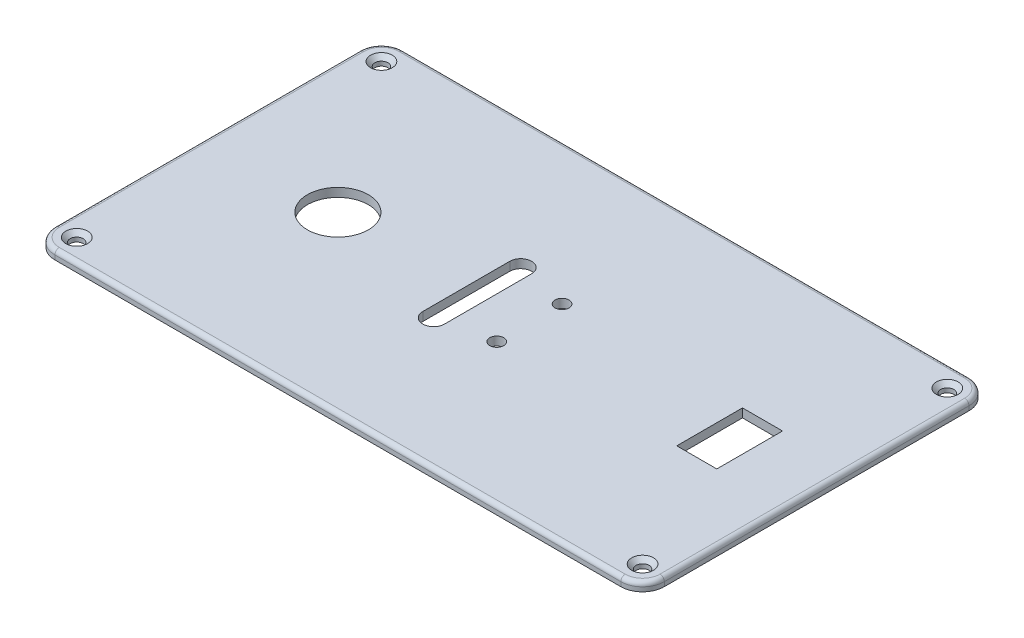
from build123d import *

# Parameters (mm, degrees)
SALIENTE_EXTRUIR1_DEPTH = 2
CROQUIS2_R              = 1.5
CORTAR_EXTRUIR1_DEPTH   = 2
CHAFL_N1_SIZE           = 1
CROQUIS3_R              = 1.6
CORTAR_EXTRUIR2_DEPTH   = 2
CROQUIS4_R              = 7
CROQUIS4_W              = 9.2
CROQUIS4_H              = 15.1
CORTAR_EXTRUIR3_DEPTH   = 2
REDONDEO1_R             = 1


with BuildPart() as part:
    # Croquis1 → Saliente-Extruir1 (new body)
    with BuildSketch(Plane(origin=(0, 0, 0), x_dir=(1, 0, 0), z_dir=(0, 1, 0))):
        with BuildLine():
            Line((-65, -40), (65, -40))
            ThreePointArc((65, -40), (68.535533906, -38.535533906), (70, -35))
            Line((70, -35), (70, 35))
            ThreePointArc((70, 35), (68.535533906, 38.535533906), (65, 40))
            Line((65, 40), (-65, 40))
            ThreePointArc((-65, 40), (-68.535533906, 38.535533906), (-70, 35))
            Line((-70, 35), (-70, -35))
            ThreePointArc((-70, -35), (-68.535533906, -38.535533906), (-65, -40))
        make_face()
    extrude(amount=SALIENTE_EXTRUIR1_DEPTH)

    # Croquis2 → Cortar-Extruir1 (cut)
    with BuildSketch(Plane(origin=(0, 2, 0), x_dir=(1, 0, 0), z_dir=(0, 1, 0))):
        with Locations(Location((65, 35, 0), (0, 0, 270))):
            Circle(CROQUIS2_R)
        with Locations(Location((65, -35, 0), (0, 0, 90))):
            Circle(CROQUIS2_R)
        with Locations(Location((-65, -35, 0), (0, 0, 270))):
            Circle(CROQUIS2_R)
        with Locations(Location((-65, 35, 0), (0, 0, 90))):
            Circle(CROQUIS2_R)
    extrude(amount=-CORTAR_EXTRUIR1_DEPTH, mode=Mode.SUBTRACT)

    # Chaflán1
    chafl_n1_edges = [part.edges().sort_by_distance(p)[0] for p in [
        (-65, 2, -33.5),
        (-65, 2, 33.5),
        (65, 2, 36.5),
        (65, 2, -36.5),
    ]]
    chamfer(chafl_n1_edges, length=CHAFL_N1_SIZE)

    # Croquis3 → Cortar-Extruir2 (cut)
    with BuildSketch(Plane(origin=(0, 2, 0), x_dir=(1, 0, 0), z_dir=(0, 1, 0))):
        with Locations(Location((4, 7.5, 0), (0, 0, 270))):
            Circle(CROQUIS3_R)
        with Locations(Location((4, -7.5, 0), (0, 0, 270))):
            Circle(CROQUIS3_R)
        with BuildLine():
            Line((-10.5, -10), (-10.5, 10))
            ThreePointArc((-10.5, 10), (-8, 12.5), (-5.5, 10))
            Line((-5.5, 10), (-5.5, -10))
            ThreePointArc((-5.5, -10), (-8, -12.5), (-10.5, -10))
        make_face()
    extrude(amount=-CORTAR_EXTRUIR2_DEPTH, mode=Mode.SUBTRACT)

    # Croquis4 → Cortar-Extruir3 (cut)
    with BuildSketch(Plane(origin=(0, 2, 0), x_dir=(1, 0, 0), z_dir=(0, 1, 0))):
        with Locations(Location((-40, 0, 0), (0, 0, 270))):
            Circle(CROQUIS4_R)
        with Locations((50, 0)):
            Rectangle(CROQUIS4_W, CROQUIS4_H)
    extrude(amount=-CORTAR_EXTRUIR3_DEPTH, mode=Mode.SUBTRACT)

    # Redondeo1
    redondeo1_edges = [part.edges().sort_by_distance(p)[0] for p in [
        (68.535533906, 2, 38.535533906),
        (70, 2, 0),
        (68.535533906, 2, -38.535533906),
        (0, 2, -40),
        (-68.535533906, 2, -38.535533906),
        (-70, 2, 0),
        (-68.535533906, 2, 38.535533906),
        (0, 2, 40),
    ]]
    fillet(redondeo1_edges, radius=REDONDEO1_R)


solid = part.part
